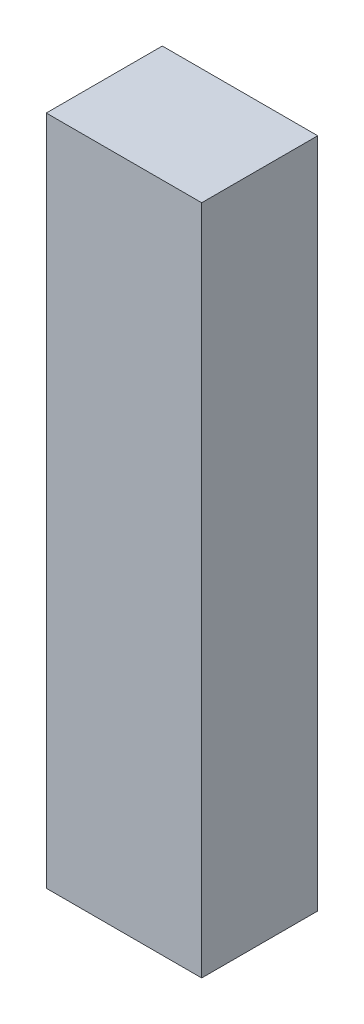
from build123d import *

# Parameters (mm, degrees)
SKETCH1_W           = 58.800188212
SKETCH1_H           = 43.904140532
BOSS_EXTRUDE1_DEPTH = 254


with BuildPart() as part:
    # Sketch1 → Boss-Extrude1 (new body)
    with BuildSketch(Plane(origin=(0, 0, 0), x_dir=(1, 0, 0), z_dir=(0, 1, 0))):
        with Locations((1.568005019, -2.548008156)):
            Rectangle(SKETCH1_W, SKETCH1_H)
    extrude(amount=BOSS_EXTRUDE1_DEPTH)


solid = part.part
